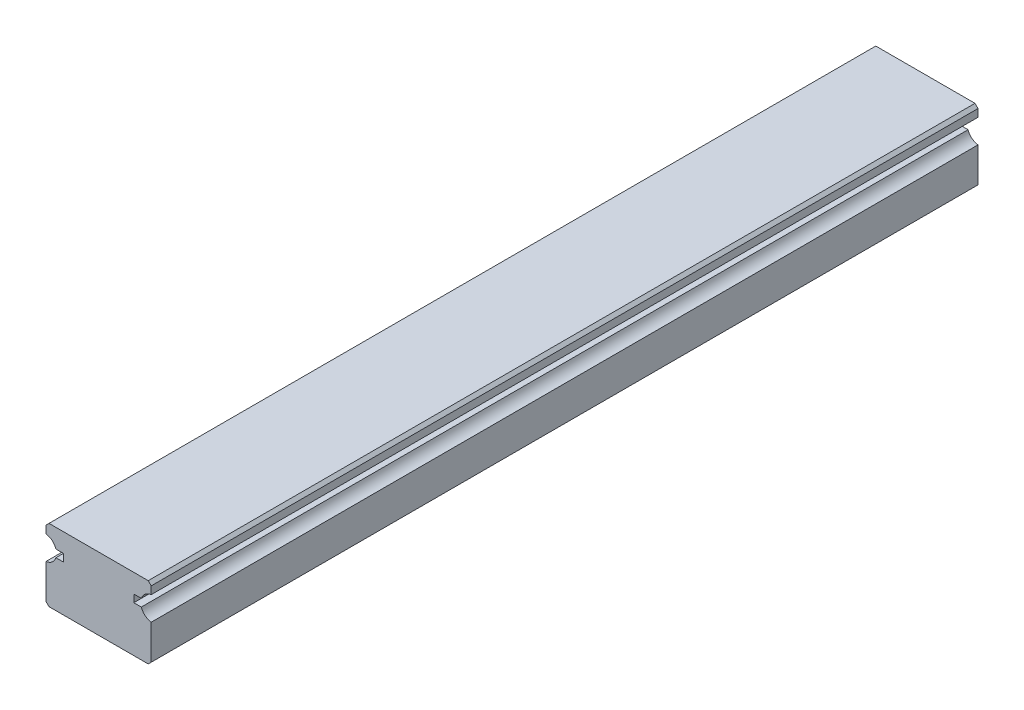
from build123d import *

# Parameters (mm, degrees)
EXTRUDE1_DEPTH = 27.5


with BuildPart() as part:
    # Sketch1 → Extrude1 (new, symmetric)
    with BuildSketch(Plane.XY):
        with BuildLine():
            Line((-3.3, -2.4), (3.3, -2.4))
            Line((3.3, -2.4), (3.5, -2.2))
            Line((3.5, -2.2), (3.5, 0.106274607))
            ThreePointArc((3.5, 0.106274607), (3.091294745, 0.282570681), (2.840065792, 0.65))
            Line((2.840065792, 0.65), (2.340065792, 0.65))
            Line((2.340065792, 0.65), (2.340065792, 1.15))
            Line((2.340065792, 1.15), (2.840065792, 1.15))
            ThreePointArc((2.840065792, 1.15), (3.091294745, 1.517429319), (3.5, 1.693725393))
            Line((3.5, 1.693725393), (3.5, 2.2))
            Line((3.5, 2.2), (3.3, 2.4))
            Line((3.3, 2.4), (-3.3, 2.4))
            Line((-3.3, 2.4), (-3.5, 2.2))
            Line((-3.5, 2.2), (-3.5, 1.693725393))
            ThreePointArc((-3.5, 1.693725393), (-3.091294745, 1.517429319), (-2.840065792, 1.15))
            Line((-2.840065792, 1.15), (-2.340065792, 1.15))
            Line((-2.340065792, 1.15), (-2.340065792, 0.65))
            Line((-2.340065792, 0.65), (-2.840065792, 0.65))
            ThreePointArc((-2.840065792, 0.65), (-3.091294745, 0.282570681), (-3.5, 0.106274607))
            Line((-3.5, 0.106274607), (-3.5, -2.2))
            Line((-3.5, -2.2), (-3.3, -2.4))
        make_face()
    extrude(amount=EXTRUDE1_DEPTH, both=True)


solid = part.part
